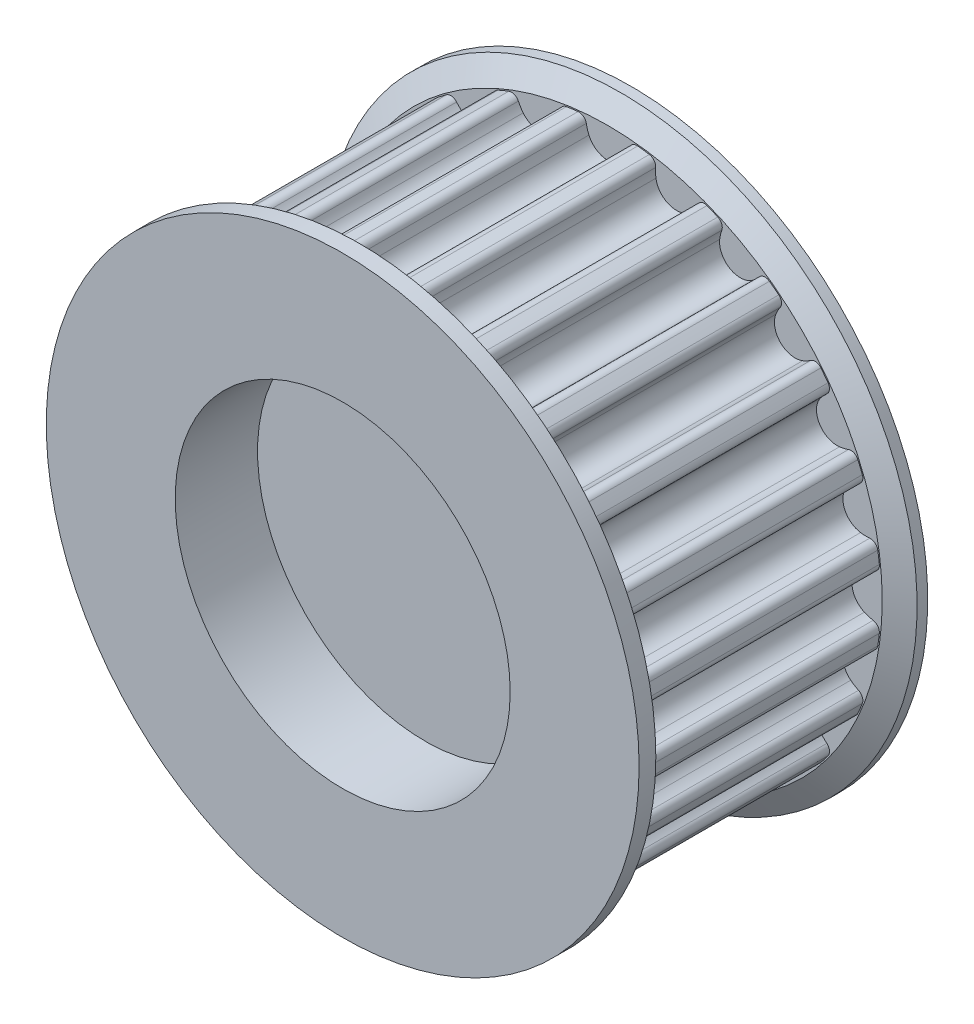
from build123d import *
from OCP.BRepFilletAPI import BRepFilletAPI_MakeChamfer

# Parameters (mm, degrees)
BOSS_EXTRUDE1_DEPTH = 16
SKETCH6_R           = 20.1175
BOSS_EXTRUDE3_DEPTH = 1.5875
BOSS_EXTRUDE4_START = 2
SKETCH7_R           = 20.1175
BOSS_EXTRUDE4_DEPTH = 2
CHAMFER3_SIZE       = 1.5
CHAMFER3_SIZE2      = 0.866025404
SKETCH8_R           = 11.3665
CUT_EXTRUDE4_DEPTH  = 5.588
CUT_EXTRUDE5_START  = -5.588
SKETCH9_R           = 11.3665
CUT_EXTRUDE5_DEPTH  = 5.588
SKETCH10_R          = 9.525
CUT_EXTRUDE6_DEPTH  = 32.708257801
SKETCH11_R          = 9.525
FOR_PRINTING_DEPTH  = 0.75


with BuildPart() as part:
    # Sketch1 → Boss-Extrude1 (new body)
    with BuildSketch(Plane.XY):
        with BuildLine():
            ThreePointArc((-1.288512298, 17.406930049), (-1.395663607, 17.699628415), (-1.467899802, 18.002837366))
            ThreePointArc((-1.467899802, 18.002837366), (-1.663509613, 18.320763062), (-2.023586107, 18.419174772))
            ThreePointArc((-2.023586107, 18.419174772), (-2.418650342, 18.371473281), (-2.812599144, 18.315299235))
            ThreePointArc((-2.812599144, 18.315299235), (-3.134935504, 18.127046168), (-3.241594847, 17.769325984))
            ThreePointArc((-3.241594847, 17.769325984), (-3.232893402, 17.457752523), (-3.260637707, 17.147294813))
            ThreePointArc((-3.260637707, 17.147294813), (-4.286431615, 15.997180572), (-5.74985232, 16.480311768))
            ThreePointArc((-5.74985232, 16.480311768), (-5.929108448, 16.735303879), (-6.077359506, 17.009485133))
            ThreePointArc((-6.077359506, 17.009485133), (-6.348589298, 17.265950229), (-6.721867308, 17.267813987))
            ThreePointArc((-6.721867308, 17.267813987), (-7.091124002, 17.119487737), (-7.457110411, 16.963266322))
            ThreePointArc((-7.457110411, 16.963266322), (-7.719739947, 16.698001035), (-7.730180164, 16.3248644))
            ThreePointArc((-7.730180164, 16.3248644), (-7.641134069, 16.026159648), (-7.587580641, 15.719099774))
            ThreePointArc((-7.587580641, 15.719099774), (-8.28075, 14.342679725), (-9.819349408, 14.430587475))
            ThreePointArc((-9.819349408, 14.430587475), (-10.058494346, 14.630496041), (-10.272657202, 14.856964598))
            ThreePointArc((-10.272657202, 14.856964598), (-10.601023115, 15.034491422), (-10.962064361, 14.939680216))
            ThreePointArc((-10.962064361, 14.939680216), (-11.28034928, 14.700837396), (-11.593431927, 14.455214843))
            ThreePointArc((-11.593431927, 14.455214843), (-11.77845687, 14.131014725), (-11.691966478, 13.767890286))
            ThreePointArc((-11.691966478, 13.767890286), (-11.528644076, 13.502410477), (-11.397442493, 13.219674061))
            ThreePointArc((-11.397442493, 13.219674061), (-11.710748957, 11.710748957), (-13.219674061, 11.397442493))
            ThreePointArc((-13.219674061, 11.397442493), (-13.502410477, 11.528644076), (-13.767890286, 11.691966478))
            ThreePointArc((-13.767890286, 11.691966478), (-14.131014725, 11.77845687), (-14.455214843, 11.593431927))
            ThreePointArc((-14.455214843, 11.593431927), (-14.700837396, 11.28034928), (-14.939680216, 10.962064361))
            ThreePointArc((-14.939680216, 10.962064361), (-15.034491422, 10.601023115), (-14.856964598, 10.272657202))
            ThreePointArc((-14.856964598, 10.272657202), (-14.630496041, 10.058494346), (-14.430587475, 9.819349408))
            ThreePointArc((-14.430587475, 9.819349408), (-14.342679725, 8.28075), (-15.719099774, 7.587580641))
            ThreePointArc((-15.719099774, 7.587580641), (-16.026159648, 7.641134069), (-16.3248644, 7.730180164))
            ThreePointArc((-16.3248644, 7.730180164), (-16.698001035, 7.719739947), (-16.963266322, 7.457110411))
            ThreePointArc((-16.963266322, 7.457110411), (-17.119487737, 7.091124002), (-17.267813987, 6.721867308))
            ThreePointArc((-17.267813987, 6.721867308), (-17.265950229, 6.348589298), (-17.009485133, 6.077359506))
            ThreePointArc((-17.009485133, 6.077359506), (-16.735303879, 5.929108448), (-16.480311768, 5.74985232))
            ThreePointArc((-16.480311768, 5.74985232), (-15.997180572, 4.286431615), (-17.147294813, 3.260637707))
            ThreePointArc((-17.147294813, 3.260637707), (-17.457752523, 3.232893402), (-17.769325984, 3.241594847))
            ThreePointArc((-17.769325984, 3.241594847), (-18.127046168, 3.134935504), (-18.315299235, 2.812599144))
            ThreePointArc((-18.315299235, 2.812599144), (-18.371473281, 2.418650342), (-18.419174772, 2.023586107))
            ThreePointArc((-18.419174772, 2.023586107), (-18.320763062, 1.663509613), (-18.002837366, 1.467899802))
            ThreePointArc((-18.002837366, 1.467899802), (-17.699628415, 1.395663607), (-17.406930049, 1.288512298))
            ThreePointArc((-17.406930049, 1.288512298), (-16.5615, 0), (-17.406930049, -1.288512298))
            ThreePointArc((-17.406930049, -1.288512298), (-17.699628415, -1.395663607), (-18.002837366, -1.467899802))
            ThreePointArc((-18.002837366, -1.467899802), (-18.320763062, -1.663509613), (-18.419174772, -2.023586107))
            ThreePointArc((-18.419174772, -2.023586107), (-18.371473281, -2.418650342), (-18.315299235, -2.812599144))
            ThreePointArc((-18.315299235, -2.812599144), (-18.127046168, -3.134935504), (-17.769325984, -3.241594847))
            ThreePointArc((-17.769325984, -3.241594847), (-17.457752523, -3.232893402), (-17.147294813, -3.260637707))
            ThreePointArc((-17.147294813, -3.260637707), (-15.997180572, -4.286431615), (-16.480311768, -5.74985232))
            ThreePointArc((-16.480311768, -5.74985232), (-16.735303879, -5.929108448), (-17.009485133, -6.077359506))
            ThreePointArc((-17.009485133, -6.077359506), (-17.265950229, -6.348589298), (-17.267813987, -6.721867308))
            ThreePointArc((-17.267813987, -6.721867308), (-17.119487737, -7.091124002), (-16.963266322, -7.457110411))
            ThreePointArc((-16.963266322, -7.457110411), (-16.698001035, -7.719739947), (-16.3248644, -7.730180164))
            ThreePointArc((-16.3248644, -7.730180164), (-16.026159648, -7.641134069), (-15.719099774, -7.587580641))
            ThreePointArc((-15.719099774, -7.587580641), (-14.342679725, -8.28075), (-14.430587475, -9.819349408))
            ThreePointArc((-14.430587475, -9.819349408), (-14.630496041, -10.058494346), (-14.856964598, -10.272657202))
            ThreePointArc((-14.856964598, -10.272657202), (-15.034491422, -10.601023115), (-14.939680216, -10.962064361))
            ThreePointArc((-14.939680216, -10.962064361), (-14.700837396, -11.28034928), (-14.455214843, -11.593431927))
            ThreePointArc((-14.455214843, -11.593431927), (-14.131014725, -11.77845687), (-13.767890286, -11.691966478))
            ThreePointArc((-13.767890286, -11.691966478), (-13.502410477, -11.528644076), (-13.219674061, -11.397442493))
            ThreePointArc((-13.219674061, -11.397442493), (-11.710748957, -11.710748957), (-11.397442493, -13.219674061))
            ThreePointArc((-11.397442493, -13.219674061), (-11.528644076, -13.502410477), (-11.691966478, -13.767890286))
            ThreePointArc((-11.691966478, -13.767890286), (-11.77845687, -14.131014725), (-11.593431927, -14.455214843))
            ThreePointArc((-11.593431927, -14.455214843), (-11.28034928, -14.700837396), (-10.962064361, -14.939680216))
            ThreePointArc((-10.962064361, -14.939680216), (-10.601023115, -15.034491422), (-10.272657202, -14.856964598))
            ThreePointArc((-10.272657202, -14.856964598), (-10.058494346, -14.630496041), (-9.819349408, -14.430587475))
            ThreePointArc((-9.819349408, -14.430587475), (-8.28075, -14.342679725), (-7.587580641, -15.719099774))
            ThreePointArc((-7.587580641, -15.719099774), (-7.641134069, -16.026159648), (-7.730180164, -16.3248644))
            ThreePointArc((-7.730180164, -16.3248644), (-7.719739947, -16.698001035), (-7.457110411, -16.963266322))
            ThreePointArc((-7.457110411, -16.963266322), (-7.091124002, -17.119487737), (-6.721867308, -17.267813987))
            ThreePointArc((-6.721867308, -17.267813987), (-6.348589298, -17.265950229), (-6.077359506, -17.009485133))
            ThreePointArc((-6.077359506, -17.009485133), (-5.929108448, -16.735303879), (-5.74985232, -16.480311768))
            ThreePointArc((-5.74985232, -16.480311768), (-4.286431615, -15.997180572), (-3.260637707, -17.147294813))
            ThreePointArc((-3.260637707, -17.147294813), (-3.232893402, -17.457752523), (-3.241594847, -17.769325984))
            ThreePointArc((-3.241594847, -17.769325984), (-3.134935504, -18.127046168), (-2.812599144, -18.315299235))
            ThreePointArc((-2.812599144, -18.315299235), (-2.418650342, -18.371473281), (-2.023586107, -18.419174772))
            ThreePointArc((-2.023586107, -18.419174772), (-1.663509613, -18.320763062), (-1.467899802, -18.002837366))
            ThreePointArc((-1.467899802, -18.002837366), (-1.395663607, -17.699628415), (-1.288512298, -17.406930049))
            ThreePointArc((-1.288512298, -17.406930049), (0, -16.5615), (1.288512298, -17.406930049))
            ThreePointArc((1.288512298, -17.406930049), (1.395663607, -17.699628415), (1.467899802, -18.002837366))
            ThreePointArc((1.467899802, -18.002837366), (1.663509613, -18.320763062), (2.023586107, -18.419174772))
            ThreePointArc((2.023586107, -18.419174772), (2.418650342, -18.371473281), (2.812599144, -18.315299235))
            ThreePointArc((2.812599144, -18.315299235), (3.134935504, -18.127046168), (3.241594847, -17.769325984))
            ThreePointArc((3.241594847, -17.769325984), (3.232893402, -17.457752523), (3.260637707, -17.147294813))
            ThreePointArc((3.260637707, -17.147294813), (4.286431615, -15.997180572), (5.74985232, -16.480311768))
            ThreePointArc((5.74985232, -16.480311768), (5.929108448, -16.735303879), (6.077359506, -17.009485133))
            ThreePointArc((6.077359506, -17.009485133), (6.348589298, -17.265950229), (6.721867308, -17.267813987))
            ThreePointArc((6.721867308, -17.267813987), (7.091124002, -17.119487737), (7.457110411, -16.963266322))
            ThreePointArc((7.457110411, -16.963266322), (7.719739947, -16.698001035), (7.730180164, -16.3248644))
            ThreePointArc((7.730180164, -16.3248644), (7.641134069, -16.026159648), (7.587580641, -15.719099774))
            ThreePointArc((7.587580641, -15.719099774), (8.28075, -14.342679725), (9.819349408, -14.430587475))
            ThreePointArc((9.819349408, -14.430587475), (10.058494346, -14.630496041), (10.272657202, -14.856964598))
            ThreePointArc((10.272657202, -14.856964598), (10.601023115, -15.034491422), (10.962064361, -14.939680216))
            ThreePointArc((10.962064361, -14.939680216), (11.28034928, -14.700837396), (11.593431927, -14.455214843))
            ThreePointArc((11.593431927, -14.455214843), (11.77845687, -14.131014725), (11.691966478, -13.767890286))
            ThreePointArc((11.691966478, -13.767890286), (11.528644076, -13.502410477), (11.397442493, -13.219674061))
            ThreePointArc((11.397442493, -13.219674061), (11.710748957, -11.710748957), (13.219674061, -11.397442493))
            ThreePointArc((13.219674061, -11.397442493), (13.502410477, -11.528644076), (13.767890286, -11.691966478))
            ThreePointArc((13.767890286, -11.691966478), (14.131014725, -11.77845687), (14.455214843, -11.593431927))
            ThreePointArc((14.455214843, -11.593431927), (14.700837396, -11.28034928), (14.939680216, -10.962064361))
            ThreePointArc((14.939680216, -10.962064361), (15.034491422, -10.601023115), (14.856964598, -10.272657202))
            ThreePointArc((14.856964598, -10.272657202), (14.630496041, -10.058494346), (14.430587475, -9.819349408))
            ThreePointArc((14.430587475, -9.819349408), (14.342679725, -8.28075), (15.719099774, -7.587580641))
            ThreePointArc((15.719099774, -7.587580641), (16.026159648, -7.641134069), (16.3248644, -7.730180164))
            ThreePointArc((16.3248644, -7.730180164), (16.698001035, -7.719739947), (16.963266322, -7.457110411))
            ThreePointArc((16.963266322, -7.457110411), (17.119487737, -7.091124002), (17.267813987, -6.721867308))
            ThreePointArc((17.267813987, -6.721867308), (17.265950229, -6.348589298), (17.009485133, -6.077359506))
            ThreePointArc((17.009485133, -6.077359506), (16.735303879, -5.929108448), (16.480311768, -5.74985232))
            ThreePointArc((16.480311768, -5.74985232), (15.997180572, -4.286431615), (17.147294813, -3.260637707))
            ThreePointArc((17.147294813, -3.260637707), (17.457752523, -3.232893402), (17.769325984, -3.241594847))
            ThreePointArc((17.769325984, -3.241594847), (18.127046168, -3.134935504), (18.315299235, -2.812599144))
            ThreePointArc((18.315299235, -2.812599144), (18.371473281, -2.418650342), (18.419174772, -2.023586107))
            ThreePointArc((18.419174772, -2.023586107), (18.320763062, -1.663509613), (18.002837366, -1.467899802))
            ThreePointArc((18.002837366, -1.467899802), (17.699628415, -1.395663607), (17.406930049, -1.288512298))
            ThreePointArc((17.406930049, -1.288512298), (16.5615, 0), (17.406930049, 1.288512298))
            ThreePointArc((17.406930049, 1.288512298), (17.699628415, 1.395663607), (18.002837366, 1.467899802))
            ThreePointArc((18.002837366, 1.467899802), (18.320763062, 1.663509613), (18.419174772, 2.023586107))
            ThreePointArc((18.419174772, 2.023586107), (18.371473281, 2.418650342), (18.315299235, 2.812599144))
            ThreePointArc((18.315299235, 2.812599144), (18.127046168, 3.134935504), (17.769325984, 3.241594847))
            ThreePointArc((17.769325984, 3.241594847), (17.457752523, 3.232893402), (17.147294813, 3.260637707))
            ThreePointArc((17.147294813, 3.260637707), (15.997180572, 4.286431615), (16.480311768, 5.74985232))
            ThreePointArc((16.480311768, 5.74985232), (16.735303879, 5.929108448), (17.009485133, 6.077359506))
            ThreePointArc((17.009485133, 6.077359506), (17.265950229, 6.348589298), (17.267813987, 6.721867308))
            ThreePointArc((17.267813987, 6.721867308), (17.119487737, 7.091124002), (16.963266322, 7.457110411))
            ThreePointArc((16.963266322, 7.457110411), (16.698001035, 7.719739947), (16.3248644, 7.730180164))
            ThreePointArc((16.3248644, 7.730180164), (16.026159648, 7.641134069), (15.719099774, 7.587580641))
            ThreePointArc((15.719099774, 7.587580641), (14.342679725, 8.28075), (14.430587475, 9.819349408))
            ThreePointArc((14.430587475, 9.819349408), (14.630496041, 10.058494346), (14.856964598, 10.272657202))
            ThreePointArc((14.856964598, 10.272657202), (15.034491422, 10.601023115), (14.939680216, 10.962064361))
            ThreePointArc((14.939680216, 10.962064361), (14.700837396, 11.28034928), (14.455214843, 11.593431927))
            ThreePointArc((14.455214843, 11.593431927), (14.131014725, 11.77845687), (13.767890286, 11.691966478))
            ThreePointArc((13.767890286, 11.691966478), (13.502410477, 11.528644076), (13.219674061, 11.397442493))
            ThreePointArc((13.219674061, 11.397442493), (11.710748957, 11.710748957), (11.397442493, 13.219674061))
            ThreePointArc((11.397442493, 13.219674061), (11.528644076, 13.502410477), (11.691966478, 13.767890286))
            ThreePointArc((11.691966478, 13.767890286), (11.77845687, 14.131014725), (11.593431927, 14.455214843))
            ThreePointArc((11.593431927, 14.455214843), (11.28034928, 14.700837396), (10.962064361, 14.939680216))
            ThreePointArc((10.962064361, 14.939680216), (10.601023115, 15.034491422), (10.272657202, 14.856964598))
            ThreePointArc((10.272657202, 14.856964598), (10.058494346, 14.630496041), (9.819349408, 14.430587475))
            ThreePointArc((9.819349408, 14.430587475), (8.28075, 14.342679725), (7.587580641, 15.719099774))
            ThreePointArc((7.587580641, 15.719099774), (7.641134069, 16.026159648), (7.730180164, 16.3248644))
            ThreePointArc((7.730180164, 16.3248644), (7.719739947, 16.698001035), (7.457110411, 16.963266322))
            ThreePointArc((7.457110411, 16.963266322), (7.091124002, 17.119487737), (6.721867308, 17.267813987))
            ThreePointArc((6.721867308, 17.267813987), (6.348589298, 17.265950229), (6.077359506, 17.009485133))
            ThreePointArc((6.077359506, 17.009485133), (5.929108448, 16.735303879), (5.74985232, 16.480311768))
            ThreePointArc((5.74985232, 16.480311768), (4.286431615, 15.997180572), (3.260637707, 17.147294813))
            ThreePointArc((3.260637707, 17.147294813), (3.232893402, 17.457752523), (3.241594847, 17.769325984))
            ThreePointArc((3.241594847, 17.769325984), (3.134935504, 18.127046168), (2.812599144, 18.315299235))
            ThreePointArc((2.812599144, 18.315299235), (2.418650342, 18.371473281), (2.023586107, 18.419174772))
            ThreePointArc((2.023586107, 18.419174772), (1.663509613, 18.320763062), (1.467899802, 18.002837366))
            ThreePointArc((1.467899802, 18.002837366), (1.395663607, 17.699628415), (1.288512298, 17.406930049))
            ThreePointArc((1.288512298, 17.406930049), (0, 16.5615), (-1.288512298, 17.406930049))
        make_face()
    extrude(amount=-BOSS_EXTRUDE1_DEPTH)

    # Sketch6 → Boss-Extrude3 (add)
    with BuildSketch(Plane(origin=(0, 0, -16), x_dir=(-1, 0, 0), z_dir=(0, 0, -1))):
        Circle(SKETCH6_R)
    extrude(amount=BOSS_EXTRUDE3_DEPTH)

    # Sketch7 → Boss-Extrude4 (add)
    with BuildSketch(Plane.XY.offset(BOSS_EXTRUDE4_START)):
        with Locations(Location((0, 0, 0), (0, 0, 180))):
            Circle(SKETCH7_R)
    extrude(amount=-BOSS_EXTRUDE4_DEPTH)

    # Chamfer3: one chamfer whose edges measure the first distance from different faces: ONE call of the kernel's chamfer builder (chamfer() names one face for all edges)
    chamfer3_edges_1 = [part.edges().sort_by_distance(p)[0] for p in [
        (20.1175, 0, -16),
    ]]
    chamfer3_side_1 = [part.faces().sort_by_distance(p)[0] for p in [
        (19.548491173, 0, -16),
    ]]
    chamfer3_edges_2 = [part.edges().sort_by_distance(p)[0] for p in [
        (20.1175, 0, 0),
    ]]
    chamfer3_side_2 = [part.faces().sort_by_distance(p)[0] for p in [
        (19.548491173, 0, 0),
    ]]
    chamfer3 = BRepFilletAPI_MakeChamfer(part.part.solid().wrapped)
    for e in chamfer3_edges_1:
        chamfer3.Add(CHAMFER3_SIZE, CHAMFER3_SIZE2, e.wrapped, chamfer3_side_1[0].wrapped)  # the first distance lies on this face
    for e in chamfer3_edges_2:
        chamfer3.Add(CHAMFER3_SIZE, CHAMFER3_SIZE2, e.wrapped, chamfer3_side_2[0].wrapped)  # the first distance lies on this face
    add(Compound.cast(chamfer3.Shape()), mode=Mode.REPLACE)

    # Sketch8 → Cut-Extrude4 (cut)
    with BuildSketch(Plane(origin=(0, 0, -17.5875), x_dir=(-1, 0, 0), z_dir=(0, 0, -1))):
        Circle(SKETCH8_R)
    extrude(amount=-CUT_EXTRUDE4_DEPTH, mode=Mode.SUBTRACT)

    # Sketch9 → Cut-Extrude5 (cut)
    with BuildSketch(Plane.XY.offset(2).offset(CUT_EXTRUDE5_START)):
        with Locations(Location((0, 0, 0), (0, 0, 180))):
            Circle(SKETCH9_R)
    extrude(amount=CUT_EXTRUDE5_DEPTH, mode=Mode.SUBTRACT)

    # Sketch10 → Cut-Extrude6 (cut, through all)
    with BuildSketch(Plane.XY.offset(-3.588)):
        Circle(SKETCH10_R)
    extrude(amount=-CUT_EXTRUDE6_DEPTH, mode=Mode.SUBTRACT)

    # Sketch11 → For Printing (add)
    with BuildSketch(Plane.XY.offset(-3.588)):
        Circle(SKETCH11_R)
    extrude(amount=-FOR_PRINTING_DEPTH)


solid = part.part
